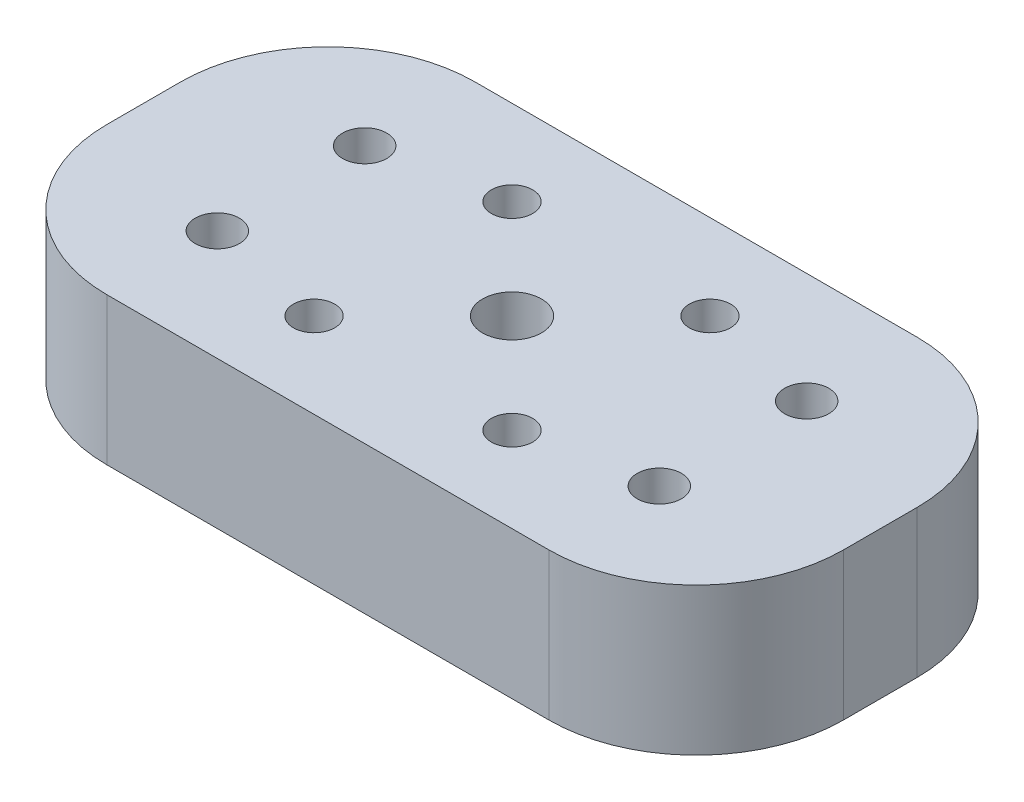
from build123d import *

# Parameters (mm, degrees)
SKETCH1_W           = 50
SKETCH1_H           = 25
BOSS_EXTRUDE1_DEPTH = 10
SKETCH2_R           = 1.5
CUT_EXTRUDE1_DEPTH  = 10
SKETCH3_R           = 1.4
CUT_EXTRUDE2_DEPTH  = 10
SKETCH4_R           = 2
CUT_EXTRUDE3_DEPTH  = 10
FILLET1_R           = 10
SKETCH5_R           = 3.5
CUT_EXTRUDE4_DEPTH  = 4


with BuildPart() as part:
    # Sketch1 → Boss-Extrude1 (new body)
    with BuildSketch(Plane(origin=(0, 0, 0), x_dir=(1, 0, 0), z_dir=(0, 1, 0))):
        Rectangle(SKETCH1_W, SKETCH1_H)
    extrude(amount=BOSS_EXTRUDE1_DEPTH)

    # Sketch2 → Cut-Extrude1 (cut)
    with BuildSketch(Plane(origin=(0, 10, 0), x_dir=(1, 0, 0), z_dir=(0, 1, 0))):
        with Locations(Location((-15, 5, 0), (0, 0, 270))):
            Circle(SKETCH2_R)
        with Locations(Location((-15, -5, 0), (0, 0, 270))):
            Circle(SKETCH2_R)
        with Locations(Location((15, -5, 0), (0, 0, 90))):
            Circle(SKETCH2_R)
        with Locations(Location((15, 5, 0), (0, 0, 90))):
            Circle(SKETCH2_R)
    extrude(amount=-CUT_EXTRUDE1_DEPTH, mode=Mode.SUBTRACT)

    # Sketch3 → Cut-Extrude2 (cut)
    with BuildSketch(Plane(origin=(0, 10, 0), x_dir=(1, 0, 0), z_dir=(0, 1, 0))):
        with Locations(Location((-6.717514421, -6.717514421, 0), (0, 0, 270))):
            Circle(SKETCH3_R)
        with Locations(Location((6.717514421, -6.717514421, 0), (0, 0, 270))):
            Circle(SKETCH3_R)
        with Locations(Location((6.717514421, 6.717514421, 0), (0, 0, 270))):
            Circle(SKETCH3_R)
        with Locations(Location((-6.717514421, 6.717514421, 0), (0, 0, 270))):
            Circle(SKETCH3_R)
    extrude(amount=-CUT_EXTRUDE2_DEPTH, mode=Mode.SUBTRACT)

    # Sketch4 → Cut-Extrude3 (cut)
    with BuildSketch(Plane(origin=(0, 10, 0), x_dir=(1, 0, 0), z_dir=(0, 1, 0))):
        with Locations(Location((0, 0, 0), (0, 0, 270))):
            Circle(SKETCH4_R)
    extrude(amount=-CUT_EXTRUDE3_DEPTH, mode=Mode.SUBTRACT)

    # Fillet1
    fillet1_edges = [part.edges().sort_by_distance(p)[0] for p in [
        (-25, 5, -12.5),
        (25, 5, -12.5),
        (25, 5, 12.5),
        (-25, 5, 12.5),
    ]]
    fillet(fillet1_edges, radius=FILLET1_R)

    # Sketch5 → Cut-Extrude4 (cut)
    with BuildSketch(Plane.XZ):
        with Locations(Location((-6.717514421, 6.717514421, 0), (0, 0, 270))):
            Circle(SKETCH5_R)
        with Locations(Location((6.717514421, 6.717514421, 0), (0, 0, 270))):
            Circle(SKETCH5_R)
        with Locations(Location((6.717514421, -6.717514421, 0), (0, 0, 270))):
            Circle(SKETCH5_R)
        with Locations(Location((-6.717514421, -6.717514421, 0), (0, 0, 270))):
            Circle(SKETCH5_R)
    extrude(amount=-CUT_EXTRUDE4_DEPTH, mode=Mode.SUBTRACT)


solid = part.part
